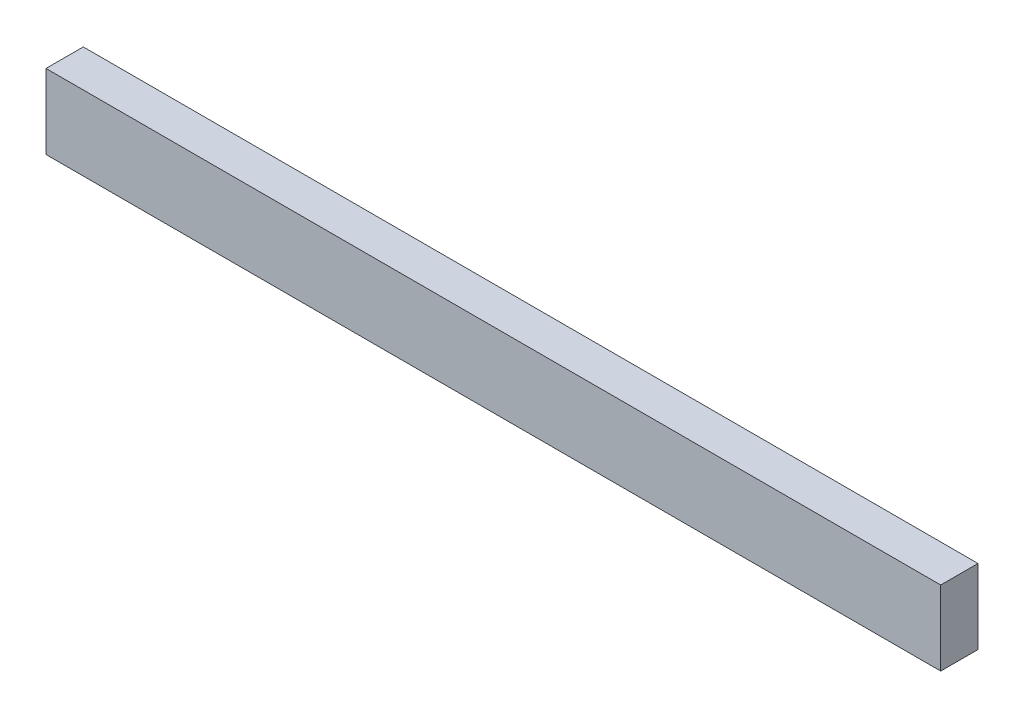
from build123d import *

# Parameters (mm, degrees)
BOSS_EXTRUDE1_DEPTH      = 25.4
BOSS_EXTRUDE1_DEPTH_BACK = 25.4
SKETCH1_W                = 1219.2
SKETCH1_H                = 101.6


with BuildPart() as part:
    # Sketch1 → Boss-Extrude1 (new, two sides: drawn at the far end of the back side and taken through both)
    with BuildSketch(Plane.XY.offset(-BOSS_EXTRUDE1_DEPTH_BACK)):
        Rectangle(SKETCH1_W, SKETCH1_H)
    extrude(amount=BOSS_EXTRUDE1_DEPTH + BOSS_EXTRUDE1_DEPTH_BACK)


solid = part.part
